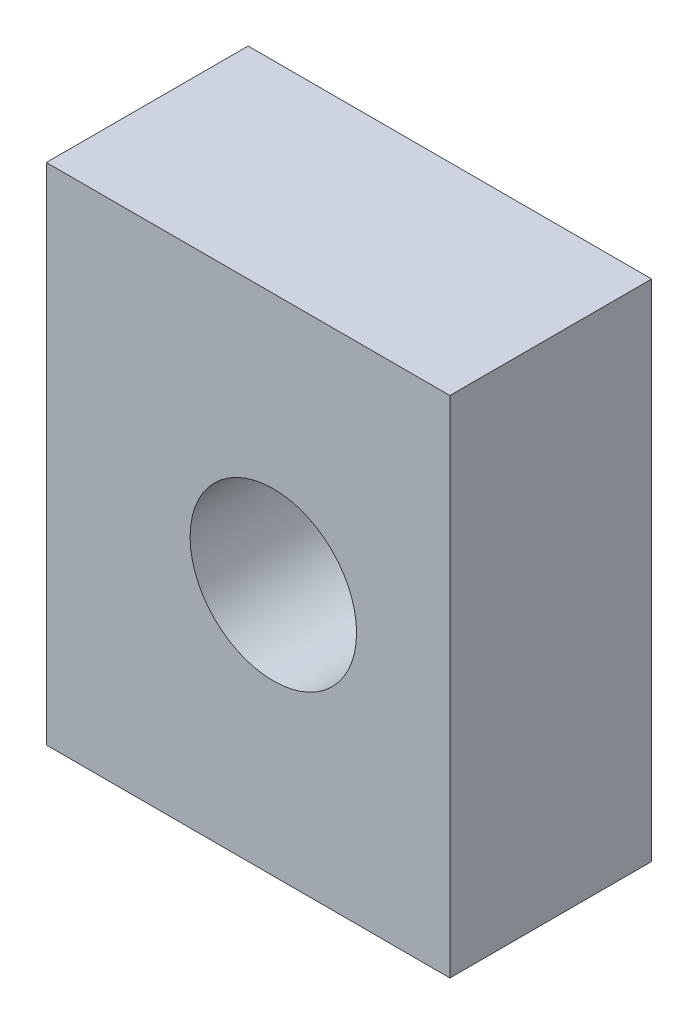
from build123d import *

# Parameters (mm, degrees)
SKETCH1_W           = 8
SKETCH1_H           = 10
SKETCH1_R           = 1.65
BOSS_EXTRUDE1_DEPTH = 4


with BuildPart() as part:
    # Sketch1 → Boss-Extrude1 (new body)
    with BuildSketch(Plane.XY):
        with Locations((4, 5)):
            Rectangle(SKETCH1_W, SKETCH1_H)
        with Locations((4.5, 5)):
            Circle(SKETCH1_R, mode=Mode.SUBTRACT)
    extrude(amount=BOSS_EXTRUDE1_DEPTH)


solid = part.part
